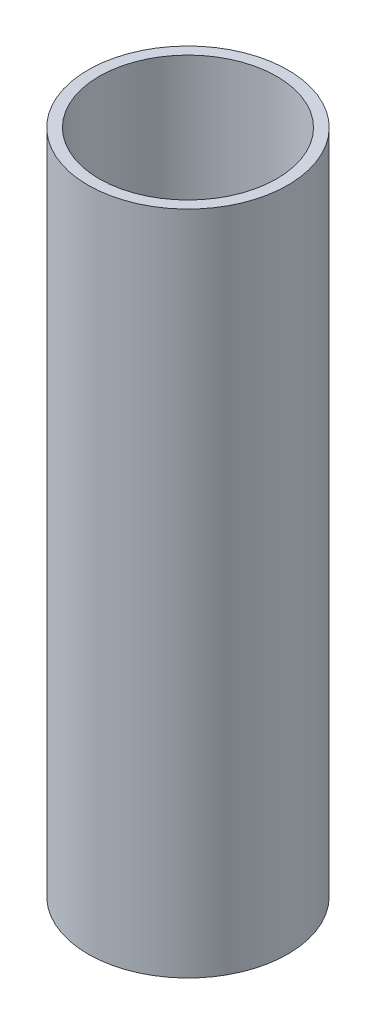
from build123d import *

# Parameters (mm, degrees)
SKETCH5_R           = 45
SKETCH5_R_2         = 40
BOSS_EXTRUDE6_DEPTH = 300


with BuildPart() as part:
    # Sketch5 → Boss-Extrude6 (new body)
    with BuildSketch(Plane(origin=(0, 0, 0), x_dir=(1, 0, 0), z_dir=(0, 1, 0))):
        with Locations(Location((0, 0, 0), (0, 0, 270))):
            Circle(SKETCH5_R)
        with Locations(Location((0, 0, 0), (0, 0, 270))):
            Circle(SKETCH5_R_2, mode=Mode.SUBTRACT)
    extrude(amount=BOSS_EXTRUDE6_DEPTH)


solid = part.part
